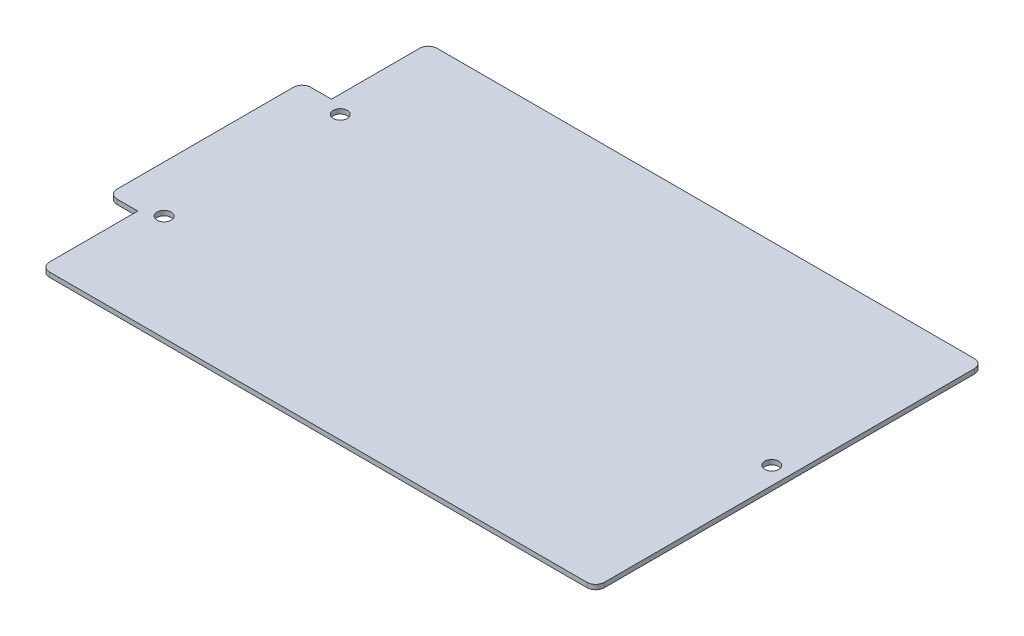
from build123d import *

# Parameters (mm, degrees)
SKETCH1_R           = 2.4
BOSS_EXTRUDE1_DEPTH = 1.6
CUT_EXTRUDE1_REACH  = 232.538
SKETCH2_W           = 10
SKETCH2_H           = 33
FILLET1_R           = 3


with BuildPart() as part:
    # Sketch1 → Boss-Extrude1 (new body)
    with BuildSketch(Plane(origin=(0, 0, 0), x_dir=(1, 0, 0), z_dir=(0, 1, 0))):
        Polygon((0, 132), (189, 132), (189, 0), (0, 0), (-10, 0), (-10, 132), align=None)
        with Locations(Location((6, 96, 0), (0, 0, 270))):
            Circle(SKETCH1_R, mode=Mode.SUBTRACT)
        with Locations(Location((6, 36, 0), (0, 0, 270))):
            Circle(SKETCH1_R, mode=Mode.SUBTRACT)
        with Locations(Location((183, 66, 0), (0, 0, 270))):
            Circle(SKETCH1_R, mode=Mode.SUBTRACT)
    extrude(amount=BOSS_EXTRUDE1_DEPTH)

    # Sketch2 → Cut-Extrude1 (cut, up to next)
    with BuildSketch(Plane(origin=(0, 1.6, 0), x_dir=(1, 0, 0), z_dir=(0, 1, 0)), mode=Mode.PRIVATE) as cut_extrude1_sk1:
        with Locations((-5, 115.5)):
            Rectangle(SKETCH2_W, SKETCH2_H)
    cut_extrude1_tool1 = extrude(cut_extrude1_sk1.sketch, amount=-CUT_EXTRUDE1_REACH, mode=Mode.PRIVATE) & part.part
    cut_extrude1 = cut_extrude1_tool1.solids().sort_by_distance((-5, 1.6, -115.5))[0]
    add(cut_extrude1, mode=Mode.SUBTRACT)

    # Mirror1: Cut-Extrude1 across plane
    add(cut_extrude1.mirror(Plane.XY.offset(-66)), mode=Mode.SUBTRACT)

    # Fillet1
    fillet1_edges = [part.edges().sort_by_distance(p)[0] for p in [
        (189, 0.8, -132),
        (189, 0.8, 0),
        (-10, 0.8, -99),
        (0, 0.8, -132),
        (-10, 0.8, -33),
        (0, 0.8, 0),
    ]]
    fillet(fillet1_edges, radius=FILLET1_R)


solid = part.part
